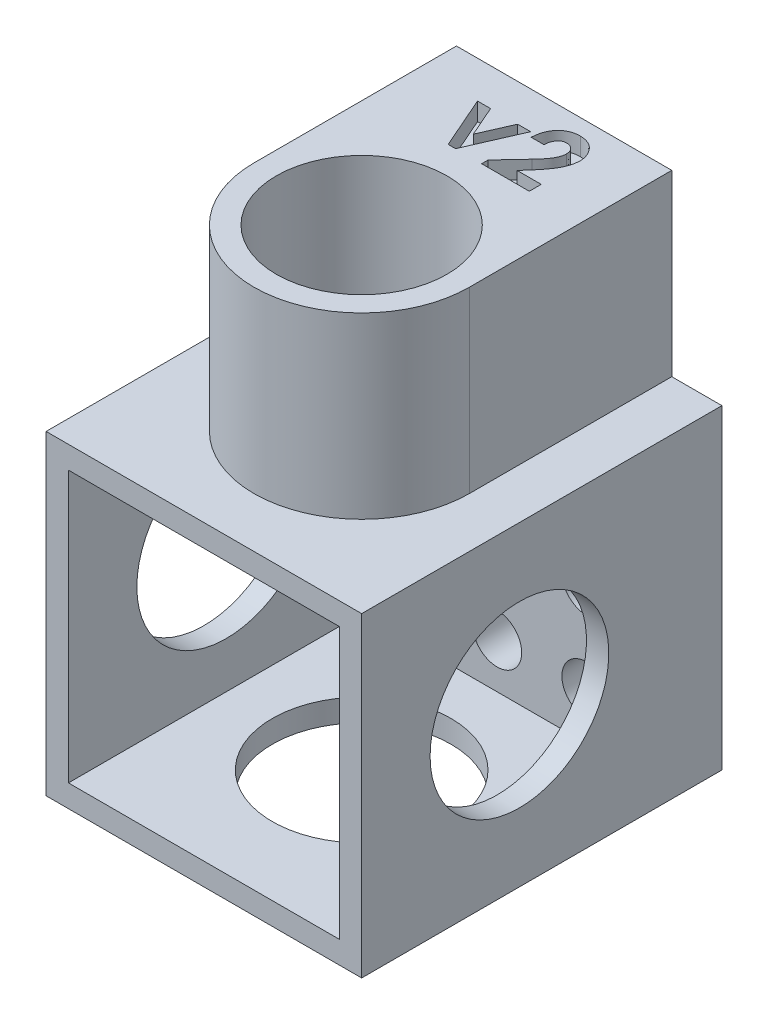
from build123d import *

# Parameters (mm, degrees)
SKETCH1_W           = 44.85
SKETCH1_H           = 44.85
SKETCH1_W_2         = 38.5
SKETCH1_H_2         = 38.5
BOSS_EXTRUDE1_DEPTH = 19.25
SKETCH2_W           = 44.85
SKETCH2_H           = 44.85
BOSS_EXTRUDE2_DEPTH = 3.175
SKETCH3_W           = 44.85
SKETCH3_H           = 44.85
BOSS_EXTRUDE3_DEPTH = 3.175
SKETCH5_R           = 12.7
CUT_EXTRUDE1_DEPTH  = 3.175
CUT_EXTRUDE2_START  = 22.425
SKETCH6_R           = 10
CUT_EXTRUDE2_DEPTH  = 41.675
SKETCH7_R           = 12.7
CUT_EXTRUDE3_DEPTH  = 55.929807482
SKETCH8_W           = 44.85
SKETCH8_H           = 44.85
SKETCH8_R           = 2.2225
BOSS_EXTRUDE4_DEPTH = 6.35
SKETCH9_R           = 3.4925
CUT_EXTRUDE4_DEPTH  = 6.35
CUT_EXTRUDE5_REACH  = 62.226
SKETCH10_W          = 38.5
SKETCH10_H          = 38.5
SKETCH11_R          = 12.1285
BOSS_EXTRUDE5_DEPTH = 25.4
CUT_EXTRUDE6_START  = 47.825
CUT_EXTRUDE6_DEPTH  = 2.54


with BuildPart() as part:
    # Sketch1 → Boss-Extrude1 (new, symmetric)
    with BuildSketch(Plane(origin=(0, 0, 0), x_dir=(1, 0, 0), z_dir=(0, 1, 0))):
        Rectangle(SKETCH1_W, SKETCH1_H)
        Rectangle(SKETCH1_W_2, SKETCH1_H_2, mode=Mode.SUBTRACT)
    extrude(amount=BOSS_EXTRUDE1_DEPTH, both=True)

    # Sketch2 → Boss-Extrude2 (add)
    with BuildSketch(Plane(origin=(0, 19.25, 0), x_dir=(1, 0, 0), z_dir=(0, 1, 0))):
        Rectangle(SKETCH2_W, SKETCH2_H)
    extrude(amount=BOSS_EXTRUDE2_DEPTH)

    # Sketch3 → Boss-Extrude3 (add)
    with BuildSketch(Plane.XZ.offset(19.25)):
        Rectangle(SKETCH3_W, SKETCH3_H)
    extrude(amount=BOSS_EXTRUDE3_DEPTH)

    # Sketch5 → Cut-Extrude1 (cut)
    with BuildSketch(Plane(origin=(0, -22.425, -22.425), x_dir=(1, 0, 0), z_dir=(0, 1, 0))):
        with Locations(Location((0, -22.425, 0), (0, 0, 90))):
            Circle(SKETCH5_R)
    extrude(amount=CUT_EXTRUDE1_DEPTH, mode=Mode.SUBTRACT)

    # Sketch6 → Cut-Extrude2 (cut)
    with BuildSketch(Plane(origin=(0, 0, 0), x_dir=(1, 0, 0), z_dir=(0, 1, 0)).offset(CUT_EXTRUDE2_START)):
        with Locations(Location((0, 0, 0), (0, 0, 270))):
            Circle(SKETCH6_R)
    extrude(amount=-CUT_EXTRUDE2_DEPTH, mode=Mode.SUBTRACT)

    # Sketch7 → Cut-Extrude3 (cut, through all)
    with BuildSketch(Plane.ZY.offset(22.425)):
        Circle(SKETCH7_R)
    extrude(amount=-CUT_EXTRUDE3_DEPTH, mode=Mode.SUBTRACT)

    # Sketch8 → Boss-Extrude4 (add)
    with BuildSketch(Plane(origin=(0, 0, -22.425), x_dir=(-1, 0, 0), z_dir=(0, 0, -1))):
        Rectangle(SKETCH8_W, SKETCH8_H)
        with Locations((-12.7, 12.7)):
            Circle(SKETCH8_R, mode=Mode.SUBTRACT)
        with Locations((0, 12.7)):
            Circle(SKETCH8_R, mode=Mode.SUBTRACT)
        with Locations((12.7, 12.7)):
            Circle(SKETCH8_R, mode=Mode.SUBTRACT)
        Circle(SKETCH8_R, mode=Mode.SUBTRACT)
        with Locations((12.7, 0)):
            Circle(SKETCH8_R, mode=Mode.SUBTRACT)
        with Locations((0, -12.7)):
            Circle(SKETCH8_R, mode=Mode.SUBTRACT)
        with Locations((12.7, -12.7)):
            Circle(SKETCH8_R, mode=Mode.SUBTRACT)
        with Locations((-12.7, 0)):
            Circle(SKETCH8_R, mode=Mode.SUBTRACT)
        with Locations((-12.7, -12.7)):
            Circle(SKETCH8_R, mode=Mode.SUBTRACT)
    extrude(amount=BOSS_EXTRUDE4_DEPTH)

    # Sketch9 → Cut-Extrude4 (cut)
    with BuildSketch(Plane.XY.offset(-19.25)):
        with Locations((12.7, 12.7)):
            Circle(SKETCH9_R)
        with Locations((0, 12.7)):
            Circle(SKETCH9_R)
        with Locations((-12.7, 12.7)):
            Circle(SKETCH9_R)
        Circle(SKETCH9_R)
        with Locations((-12.7, 0)):
            Circle(SKETCH9_R)
        with Locations((0, -12.7)):
            Circle(SKETCH9_R)
        with Locations((-12.7, -12.7)):
            Circle(SKETCH9_R)
        with Locations((12.7, 0)):
            Circle(SKETCH9_R)
        with Locations((12.7, -12.7)):
            Circle(SKETCH9_R)
    extrude(amount=-CUT_EXTRUDE4_DEPTH, mode=Mode.SUBTRACT)

    # Sketch10 → Cut-Extrude5 (cut, up to next)
    with BuildSketch(Plane.XY.offset(22.425), mode=Mode.PRIVATE) as cut_extrude5_sk1:
        Rectangle(SKETCH10_W, SKETCH10_H)
    cut_extrude5_tool1 = extrude(cut_extrude5_sk1.sketch, amount=-CUT_EXTRUDE5_REACH, mode=Mode.PRIVATE) & part.part
    add(cut_extrude5_tool1.solids().sort_by_distance((0, 0, 22.425))[0], mode=Mode.SUBTRACT)

    # Sketch11 → Boss-Extrude5 (add)
    with BuildSketch(Plane(origin=(0, 22.425, 0), x_dir=(1, 0, 0), z_dir=(0, 1, 0))):
        with BuildLine():
            Line((-15.3035, 0), (-15.3035, 28.775))
            Line((-15.3035, 28.775), (15.3035, 28.775))
            Line((15.3035, 28.775), (15.3035, 0))
            ThreePointArc((15.3035, 0), (0, -15.3035), (-15.3035, 0))
        make_face()
        with Locations(Location((0, 0, 0), (0, 0, 270))):
            Circle(SKETCH11_R, mode=Mode.SUBTRACT)
    extrude(amount=BOSS_EXTRUDE5_DEPTH)

    # Sketch12 → Cut-Extrude6 (cut)
    with BuildSketch(Plane(origin=(0, 0, 0), x_dir=(1, 0, 0), z_dir=(0, 1, 0)).offset(CUT_EXTRUDE6_START)):
        Polygon((-7.032749725, 23.499615385), (-5.176595879, 23.499615385), (-3.255313828, 19.117708333), (-1.334031776, 23.499615385), (0.52212207, 23.499615385), (-2.730217674, 16.075), (-3.780409982, 16.075), align=None)
        with BuildLine():
            Line((3.06212207, 22.848333333), (1.238532326, 22.848333333))
            add(Edge.make_bspline(
                [(1.238532326, 22.848333333), (1.246408131, 22.98627825), (1.26179698, 23.255814335), (1.323009931, 23.647324128), (1.405033186, 24.017257831), (1.514504108, 24.364321375), (1.652061484, 24.688388647), (1.814165609, 24.990564412), (2.004957875, 25.269257707), (2.220377594, 25.523124515), (2.456767534, 25.750870772), (2.709220005, 25.95280491), (2.98159661, 26.119435879), (3.268920804, 26.25655774), (3.571143663, 26.366111735), (3.891124689, 26.439357446), (4.226093313, 26.488960159), (4.455406461, 26.493300596), (4.572282326, 26.495512821)],
                knots=[0, 0, 0, 0, 1.199038563, 2.342849363, 3.436047546, 4.486744587, 5.497670872, 6.488682221, 7.459191391, 8.424610317, 9.374430501, 10.305433194, 11.225809216, 12.140057399, 13.06607119, 14.010487599, 14.985989317, 16, 16, 16, 16], degree=3))
            add(Edge.make_bspline(
                [(4.572282326, 26.495512821), (4.715745792, 26.491036382), (4.995820098, 26.482297326), (5.402790279, 26.407750272), (5.782855932, 26.283058805), (6.135740783, 26.108831941), (6.458440664, 25.887494974), (6.75090206, 25.623586865), (7.004280474, 25.311570683), (7.220182398, 24.964428914), (7.399571093, 24.596854636), (7.525279218, 24.216767589), (7.607905816, 23.834253744), (7.616718454, 23.576688282), (7.621096429, 23.448733974)],
                knots=[0, 0, 0, 0, 1.075374347, 2.099382735, 3.09057751, 4.06680945, 5.040638231, 6.016817125, 7.011024321, 8.044445721, 9.0776792, 10.070479129, 11.0414456, 12, 12, 12, 12], degree=3))
            add(Edge.make_bspline(
                [(7.621096429, 23.448733974), (7.619391877, 23.371338166), (7.615961034, 23.215559521), (7.592105933, 22.979828197), (7.556318567, 22.739708284), (7.50235994, 22.495405661), (7.435069108, 22.246851846), (7.353435604, 21.993303005), (7.255565857, 21.736196664), (7.143093114, 21.472639138), (7.008912847, 21.201774756), (6.852678577, 20.919543158), (6.670243493, 20.626194704), (6.463811181, 20.320073055), (6.232379047, 20.00166101), (5.974817317, 19.671917726), (5.694092498, 19.329681294), (5.494854196, 19.100915445), (5.392490659, 18.98338141)],
                knots=[0, 0, 0, 0, 0.728284026, 1.46585585, 2.227944881, 3.01186502, 3.81876927, 4.650621989, 5.517437689, 6.406905708, 7.346299482, 8.360816762, 9.441613733, 10.596154504, 11.834900912, 13.145207542, 14.533280747, 16, 16, 16, 16], degree=3))
            Line((5.392490659, 18.98338141), (4.33212207, 17.768333333))
            Line((4.33212207, 17.768333333), (7.751352839, 17.768333333))
            Line((7.751352839, 17.768333333), (7.751352839, 16.075))
            Line((7.751352839, 16.075), (0.978019506, 16.075))
            Line((0.978019506, 16.075), (0.978019506, 16.99900641))
            Line((0.978019506, 16.99900641), (3.98612848, 20.200464744))
            add(Edge.make_bspline(
                [(3.98612848, 20.200464744), (4.073220965, 20.293852277), (4.241893281, 20.474716236), (4.481896603, 20.7403342), (4.69907841, 20.992399308), (4.888935258, 21.233595544), (5.061430592, 21.456099485), (5.208872858, 21.666617676), (5.332611037, 21.863246958), (5.46694638, 22.10034753), (5.594520797, 22.383132155), (5.711578046, 22.708911637), (5.782932539, 23.020281793), (5.792781716, 23.22317728), (5.797506685, 23.320512821)],
                knots=[0, 0, 0, 0, 1.246127091, 2.413378631, 3.493388633, 4.492180848, 5.408488754, 6.240484944, 6.999099869, 7.674939598, 8.898438119, 10.020720584, 11.050475521, 12, 12, 12, 12], degree=3))
            add(Edge.make_bspline(
                [(5.797506685, 23.320512821), (5.79397394, 23.414677447), (5.787128679, 23.597136506), (5.711904814, 23.856683548), (5.595365392, 24.091676899), (5.431144887, 24.295094693), (5.232222423, 24.462256582), (5.002348831, 24.5865869), (4.743398255, 24.658324923), (4.561868968, 24.667303961), (4.468484249, 24.671923077)],
                knots=[0, 0, 0, 0, 1.062038974, 2.057870785, 3.028805853, 4.01125022, 4.991535629, 5.949134679, 6.94496649, 8, 8, 8, 8], degree=3))
            add(Edge.make_bspline(
                [(4.468484249, 24.671923077), (4.420240514, 24.67021672), (4.325264974, 24.666857482), (4.185658353, 24.644495946), (4.052812623, 24.605086073), (3.925249138, 24.552282391), (3.804329288, 24.48229073), (3.690358071, 24.396014857), (3.582134658, 24.295647238), (3.480155402, 24.181501708), (3.387340967, 24.054115264), (3.304903526, 23.91465132), (3.236741485, 23.763196445), (3.176729147, 23.601750075), (3.13044476, 23.428578144), (3.096743985, 23.244717066), (3.071123536, 23.050465961), (3.065177143, 22.916936592), (3.06212207, 22.848333333)],
                knots=[0, 0, 0, 0, 0.903469896, 1.778625579, 2.63899355, 3.493148037, 4.358286772, 5.247621495, 6.164656832, 7.118446693, 8.109501108, 9.111810964, 10.146451449, 11.215617525, 12.33435995, 13.498009769, 14.714554818, 16, 16, 16, 16], degree=3))
        make_face()
    extrude(amount=-CUT_EXTRUDE6_DEPTH, mode=Mode.SUBTRACT)


solid = part.part
